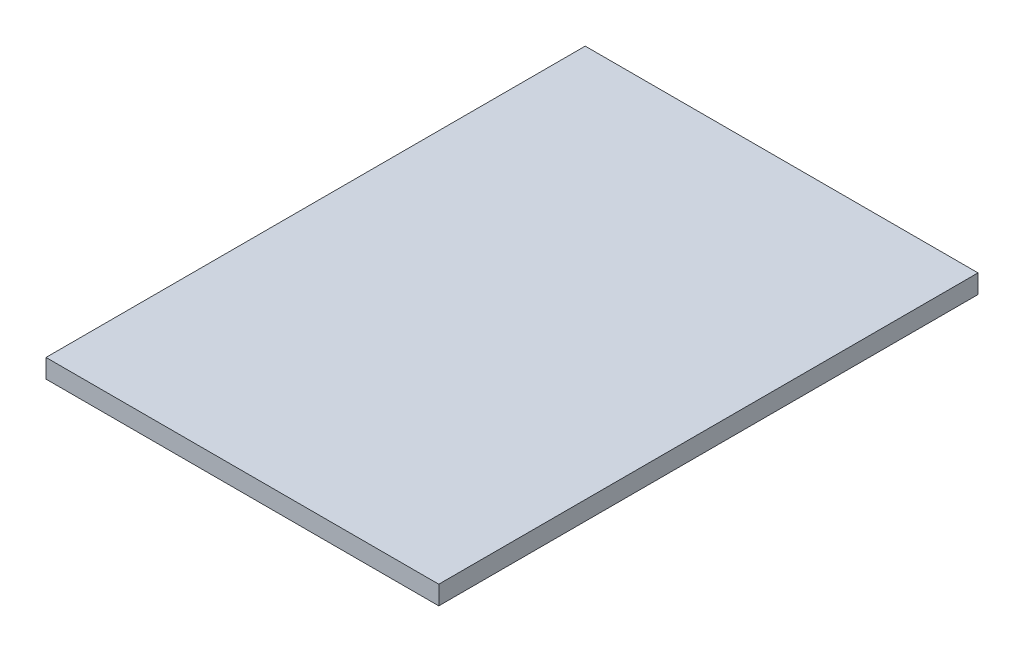
from build123d import *

# Parameters (mm, degrees)
SKETCH1_W           = 132.703222604
SKETCH1_H           = 182.189109652
BOSS_EXTRUDE1_DEPTH = 6.35


with BuildPart() as part:
    # Sketch1 → Boss-Extrude1 (new body)
    with BuildSketch(Plane(origin=(0, 0, 0), x_dir=(1, 0, 0), z_dir=(0, 1, 0))):
        Rectangle(SKETCH1_W, SKETCH1_H)
    extrude(amount=BOSS_EXTRUDE1_DEPTH)


solid = part.part
